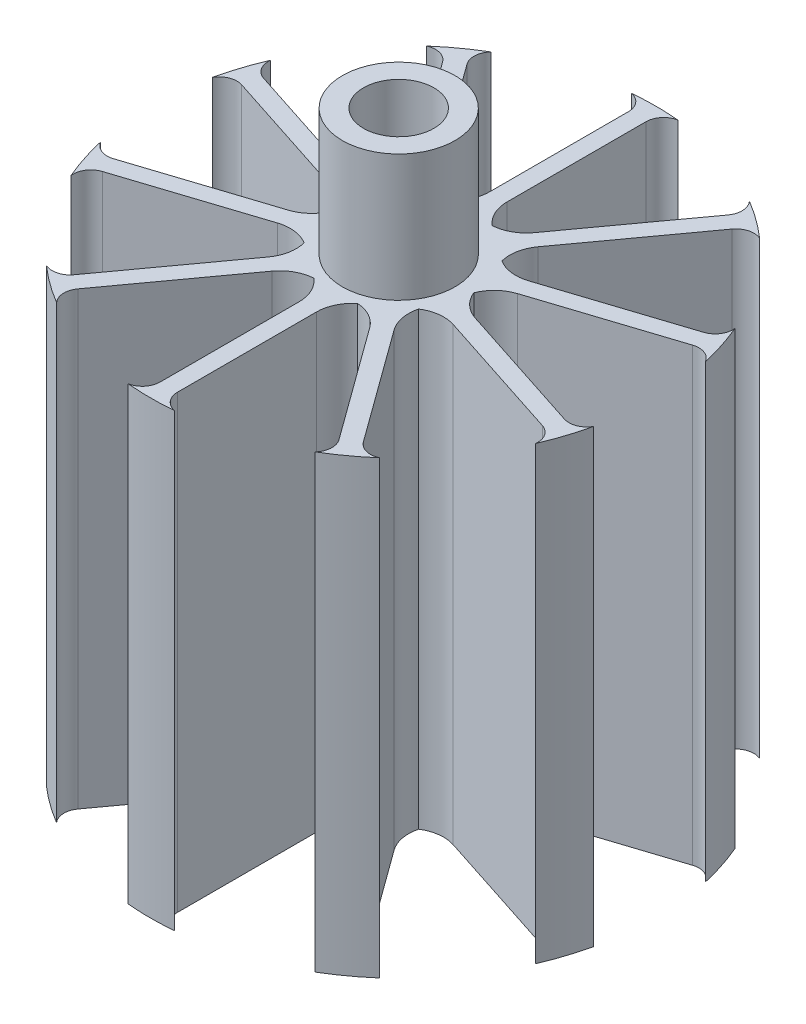
from build123d import *

# Parameters (mm, degrees)
EXTRUDE_1_DEPTH     = 32
SKETCH_3_R          = 4
EXTRUDE_2_DEPTH     = 9
SKETCH_4_R          = 2.5
CUT_EXTRUDE_1_DEPTH = 49.174035829


with BuildPart() as part:
    # 草图2 → 凸台-拉伸1 (new body)
    with BuildSketch(Plane(origin=(0, 0, 0), x_dir=(1, 0, 0), z_dir=(0, 1, 0))):
        with BuildLine():
            Line((-0.620533184, 16.939122741), (-0.620533184, 7.076499426))
            ThreePointArc((-0.620533184, 7.076499426), (-0.865551691, 5.978035603), (-1.554155931, 5.087821563))
            ThreePointArc((-1.554155931, 5.087821563), (-2.634503149, 5.403268433), (-3.47838812, 6.147926068))
            Line((-3.47838812, 6.147926068), (-9.275492654, 14.126955939))
            ThreePointArc((-9.275492654, 14.126955939), (-9.514491938, 14.94638072), (-9.177971495, 15.730811482))
            ThreePointArc((-9.177971495, 15.730811482), (-10.550745279, 14.826476488), (-11.835029396, 13.800345917))
            ThreePointArc((-11.835029396, 13.800345917), (-10.985000873, 13.877993441), (-10.279536436, 13.397475432))
            Line((-10.279536436, 13.397475432), (-4.482431902, 5.41844556))
            ThreePointArc((-4.482431902, 5.41844556), (-4.034995203, 4.385751395), (-4.068833052, 3.260801691))
            ThreePointArc((-4.068833052, 3.260801691), (-5.128267329, 2.880991407), (-6.248683387, 2.987408949))
            Line((-6.248683387, 2.987408949), (-15.62859556, 6.035127162))
            ThreePointArc((-15.62859556, 6.035127162), (-16.303595844, 6.557575481), (-16.49242192, 7.389995052))
            ThreePointArc((-16.49242192, 7.389995052), (-17.071464467, 5.851476488), (-17.507327728, 4.266436154))
            ThreePointArc((-17.507327728, 4.266436154), (-16.865280276, 4.82888855), (-16.012106158, 4.854802907))
            Line((-16.012106158, 4.854802907), (-6.632193986, 1.807084693))
            ThreePointArc((-6.632193986, 1.807084693), (-5.663207692, 1.234614256), (-5.029354242, 0.304621439))
            ThreePointArc((-5.029354242, 0.304621439), (-5.663207692, -0.625371378), (-6.632193986, -1.197841815))
            Line((-6.632193986, -1.197841815), (-16.012106158, -4.245560029))
            ThreePointArc((-16.012106158, -4.245560029), (-16.865280276, -4.219645672), (-17.507327728, -3.657193276))
            ThreePointArc((-17.507327728, -3.657193276), (-17.071464467, -5.24223361), (-16.49242192, -6.780752173))
            ThreePointArc((-16.49242192, -6.780752173), (-16.303595844, -5.948332603), (-15.62859556, -5.425884284))
            Line((-15.62859556, -5.425884284), (-6.248683387, -2.37816607))
            ThreePointArc((-6.248683387, -2.37816607), (-5.128267329, -2.271748529), (-4.068833052, -2.651558813))
            ThreePointArc((-4.068833052, -2.651558813), (-4.034995203, -3.776508517), (-4.482431902, -4.809202682))
            Line((-4.482431902, -4.809202682), (-10.279536436, -12.788232554))
            ThreePointArc((-10.279536436, -12.788232554), (-10.985000873, -13.268750563), (-11.835029396, -13.191103039))
            ThreePointArc((-11.835029396, -13.191103039), (-10.550745279, -14.21723361), (-9.177971495, -15.121568604))
            ThreePointArc((-9.177971495, -15.121568604), (-9.514491938, -14.337137842), (-9.275492654, -13.517713061))
            Line((-9.275492654, -13.517713061), (-3.47838812, -5.53868319))
            ThreePointArc((-3.47838812, -5.53868319), (-2.634503149, -4.794025555), (-1.554155931, -4.478578685))
            ThreePointArc((-1.554155931, -4.478578685), (-0.865551691, -5.368792725), (-0.620533184, -6.467256547))
            Line((-0.620533184, -6.467256547), (-0.620533184, -16.329879863))
            ThreePointArc((-0.620533184, -16.329879863), (-0.908824502, -17.133288691), (-1.642152093, -17.570104755))
            ThreePointArc((-1.642152093, -17.570104755), (0, -17.645378561), (1.642152093, -17.570104755))
            ThreePointArc((1.642152093, -17.570104755), (0.908824502, -17.133288691), (0.620533184, -16.329879863))
            Line((0.620533184, -16.329879863), (0.620533184, -6.467256547))
            ThreePointArc((0.620533184, -6.467256547), (0.865551691, -5.368792725), (1.554155931, -4.478578685))
            ThreePointArc((1.554155931, -4.478578685), (2.634503149, -4.794025555), (3.47838812, -5.53868319))
            Line((3.47838812, -5.53868319), (9.275492654, -13.517713061))
            ThreePointArc((9.275492654, -13.517713061), (9.514491938, -14.337137842), (9.177971495, -15.121568604))
            ThreePointArc((9.177971495, -15.121568604), (10.550745279, -14.21723361), (11.835029396, -13.191103039))
            ThreePointArc((11.835029396, -13.191103039), (10.985000873, -13.268750563), (10.279536436, -12.788232554))
            Line((10.279536436, -12.788232554), (4.482431902, -4.809202682))
            ThreePointArc((4.482431902, -4.809202682), (4.034995203, -3.776508517), (4.068833052, -2.651558813))
            ThreePointArc((4.068833052, -2.651558813), (5.128267329, -2.271748529), (6.248683387, -2.37816607))
            Line((6.248683387, -2.37816607), (15.62859556, -5.425884284))
            ThreePointArc((15.62859556, -5.425884284), (16.303595844, -5.948332603), (16.49242192, -6.780752173))
            ThreePointArc((16.49242192, -6.780752173), (17.071464467, -5.24223361), (17.507327728, -3.657193276))
            ThreePointArc((17.507327728, -3.657193276), (16.865280276, -4.219645672), (16.012106158, -4.245560029))
            Line((16.012106158, -4.245560029), (6.632193986, -1.197841815))
            ThreePointArc((6.632193986, -1.197841815), (5.663207692, -0.625371378), (5.029354242, 0.304621439))
            ThreePointArc((5.029354242, 0.304621439), (5.663207692, 1.234614256), (6.632193986, 1.807084693))
            Line((6.632193986, 1.807084693), (16.012106158, 4.854802907))
            ThreePointArc((16.012106158, 4.854802907), (16.865280276, 4.82888855), (17.507327728, 4.266436154))
            ThreePointArc((17.507327728, 4.266436154), (17.071464467, 5.851476488), (16.49242192, 7.389995052))
            ThreePointArc((16.49242192, 7.389995052), (16.303595844, 6.557575481), (15.62859556, 6.035127162))
            Line((15.62859556, 6.035127162), (6.248683387, 2.987408949))
            ThreePointArc((6.248683387, 2.987408949), (5.128267329, 2.880991407), (4.068833052, 3.260801691))
            ThreePointArc((4.068833052, 3.260801691), (4.034995203, 4.385751395), (4.482431902, 5.41844556))
            Line((4.482431902, 5.41844556), (10.279536436, 13.397475432))
            ThreePointArc((10.279536436, 13.397475432), (10.985000873, 13.877993441), (11.835029396, 13.800345917))
            ThreePointArc((11.835029396, 13.800345917), (10.550745279, 14.826476488), (9.177971495, 15.730811482))
            ThreePointArc((9.177971495, 15.730811482), (9.514491938, 14.94638072), (9.275492654, 14.126955939))
            Line((9.275492654, 14.126955939), (3.47838812, 6.147926068))
            ThreePointArc((3.47838812, 6.147926068), (2.634503149, 5.403268433), (1.554155931, 5.087821563))
            ThreePointArc((1.554155931, 5.087821563), (0.865551691, 5.978035603), (0.620533184, 7.076499426))
            Line((0.620533184, 7.076499426), (0.620533184, 16.939122741))
            ThreePointArc((0.620533184, 16.939122741), (0.908824502, 17.742531569), (1.642152093, 18.179347633))
            ThreePointArc((1.642152093, 18.179347633), (0, 18.254621439), (-1.642152093, 18.179347633))
            ThreePointArc((-1.642152093, 18.179347633), (-0.908824502, 17.742531569), (-0.620533184, 16.939122741))
        make_face()
    extrude(amount=EXTRUDE_1_DEPTH)

    # 草图3 → 凸台-拉伸2 (add)
    with BuildSketch(Plane(origin=(0, 32, 0), x_dir=(1, 0, 0), z_dir=(0, 1, 0))):
        with Locations(Location((0, 0, 0), (0, 0, 270))):
            Circle(SKETCH_3_R)
    extrude(amount=EXTRUDE_2_DEPTH)

    # 草图4 → 切除-拉伸1 (cut, through all)
    with BuildSketch(Plane(origin=(0, 41, 0), x_dir=(1, 0, 0), z_dir=(0, 1, 0))):
        with Locations(Location((0, 0, 0), (0, 0, 270))):
            Circle(SKETCH_4_R)
    extrude(amount=-CUT_EXTRUDE_1_DEPTH, mode=Mode.SUBTRACT)


solid = part.part
